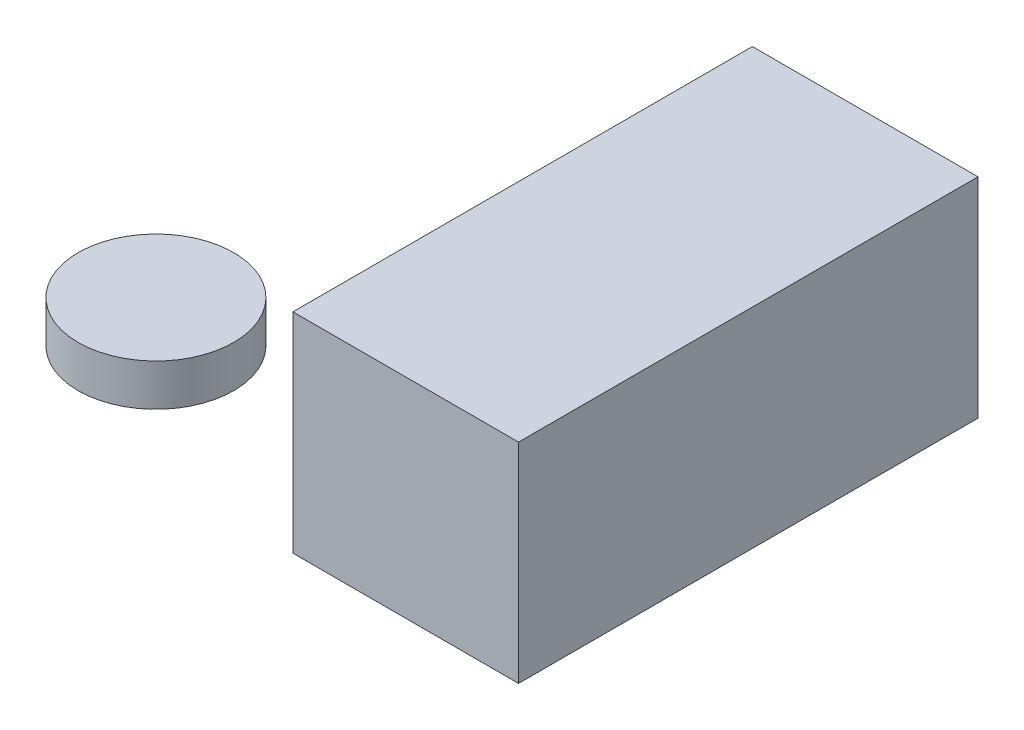
from build123d import *

# Parameters (mm, degrees)
SKETCH_2_W      = 53.97046527
SKETCH_2_H      = 109.913126842
EXTRUDE_1_DEPTH = 50
SKETCH_3_R      = 5
EXTRUDE_2_DEPTH = 10
SKETCH_4_R      = 18.614297515
EXTRUDE_3_DEPTH = 10


with BuildPart() as part:
    # 草图2 → 凸台-拉伸1 (new body)
    with BuildSketch(Plane(origin=(0, 0, 0), x_dir=(1, 0, 0), z_dir=(0, 1, 0))):
        Rectangle(SKETCH_2_W, SKETCH_2_H)
    extrude(amount=EXTRUDE_1_DEPTH)


with BuildPart() as body_2:
    # 草图3 → 凸台-拉伸2 (new body)
    with BuildSketch(Plane(origin=(0, 0, 0), x_dir=(1, 0, 0), z_dir=(0, 1, 0))):
        with Locations(Location((-56.985232635, 0, 0), (0, 0, 270))):
            Circle(SKETCH_3_R)
    extrude(amount=EXTRUDE_2_DEPTH)


with BuildPart() as body_3:
    # 草图4 → 凸台-拉伸3 (new body)
    with BuildSketch(Plane(origin=(0, 0, 0), x_dir=(1, 0, 0), z_dir=(0, 1, 0))):
        with Locations(Location((-86.336843383, -28.377393169, 0), (0, 0, 270))):
            Circle(SKETCH_4_R)
    extrude(amount=EXTRUDE_3_DEPTH)


solid = Compound([part.part, body_2.part, body_3.part])
